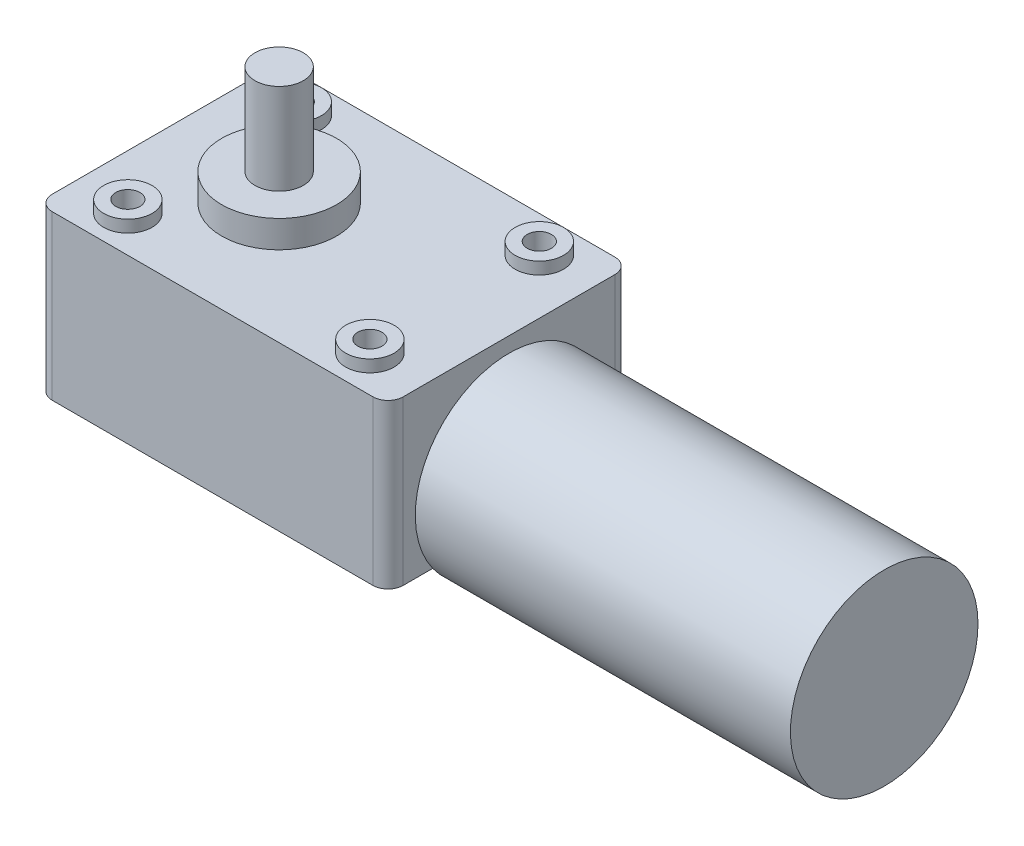
from build123d import *

# Parameters (mm, degrees)
BOSS_EXTRUDE1_DEPTH = 13.5
SKETCH2_R           = 4
BOSS_EXTRUDE2_DEPTH = 2
SKETCH3_R           = 2
CUT_EXTRUDE1_DEPTH  = 6
SKETCH6_R           = 9.5
BOSS_EXTRUDE5_DEPTH = 4.5
SKETCH4_R           = 4
BOSS_EXTRUDE3_DEPTH = 15
SKETCH5_R           = 15.5
BOSS_EXTRUDE4_DEPTH = 62
SKETCH7_R           = 4
CUT_EXTRUDE2_DEPTH  = 1.7


with BuildPart() as part:
    # Sketch1 → Boss-Extrude1 (new, symmetric)
    with BuildSketch(Plane(origin=(0, 0, 0), x_dir=(1, 0, 0), z_dir=(0, 1, 0))):
        with BuildLine():
            Line((-26.5, -20), (26.5, -20))
            ThreePointArc((26.5, -20), (28.267766953, -19.267766953), (29, -17.5))
            Line((29, -17.5), (29, 17.5))
            ThreePointArc((29, 17.5), (28.267766953, 19.267766953), (26.5, 20))
            Line((26.5, 20), (-26.5, 20))
            ThreePointArc((-26.5, 20), (-28.267766953, 19.267766953), (-29, 17.5))
            Line((-29, 17.5), (-29, -17.5))
            ThreePointArc((-29, -17.5), (-28.267766953, -19.267766953), (-26.5, -20))
        make_face()
    extrude(amount=BOSS_EXTRUDE1_DEPTH, both=True)

    # Sketch2 → Boss-Extrude2 (add)
    with BuildSketch(Plane(origin=(0, 13.5, 0), x_dir=(1, 0, 0), z_dir=(0, 1, 0))):
        with Locations(Location((-20, 14, 0), (0, 0, 270))):
            Circle(SKETCH2_R)
        with Locations(Location((-20, -14, 0), (0, 0, 270))):
            Circle(SKETCH2_R)
        with Locations(Location((20, -14, 0), (0, 0, 270))):
            Circle(SKETCH2_R)
        with Locations(Location((20, 14, 0), (0, 0, 270))):
            Circle(SKETCH2_R)
    boss_extrude2 = extrude(amount=BOSS_EXTRUDE2_DEPTH)

    # Sketch3 → Cut-Extrude1 (cut)
    with BuildSketch(Plane(origin=(0, 15.5, 0), x_dir=(1, 0, 0), z_dir=(0, 1, 0))):
        with Locations(Location((-20, 14, 0), (0, 0, 270))):
            Circle(SKETCH3_R)
        with Locations(Location((20, 14, 0), (0, 0, 270))):
            Circle(SKETCH3_R)
        with Locations(Location((20, -14, 0), (0, 0, 270))):
            Circle(SKETCH3_R)
        with Locations(Location((-20, -14, 0), (0, 0, 270))):
            Circle(SKETCH3_R)
    cut_extrude1 = extrude(amount=-CUT_EXTRUDE1_DEPTH, mode=Mode.SUBTRACT)

    # Sketch6 → Boss-Extrude5 (add)
    with BuildSketch(Plane(origin=(0, 13.5, 0), x_dir=(1, 0, 0), z_dir=(0, 1, 0))):
        with Locations(Location((-9, 0, 0), (0, 0, 270))):
            Circle(SKETCH6_R)
    boss_extrude5 = extrude(amount=BOSS_EXTRUDE5_DEPTH)

    # Sketch4 → Boss-Extrude3 (add)
    with BuildSketch(Plane(origin=(0, 18, 0), x_dir=(1, 0, 0), z_dir=(0, 1, 0))):
        with Locations(Location((-9, 0, 0), (0, 0, 270))):
            Circle(SKETCH4_R)
    extrude(amount=BOSS_EXTRUDE3_DEPTH)

    # Sketch5 → Boss-Extrude4 (add)
    with BuildSketch(Plane(origin=(29, 0, 0), x_dir=(0, 0, -1), z_dir=(1, 0, 0))):
        with Locations(Location((0, -4.5, 0), (0, 0, 215.49593265))):
            Circle(SKETCH5_R)
    extrude(amount=BOSS_EXTRUDE4_DEPTH)

    # Mirror2: Boss-Extrude2, Cut-Extrude1, Boss-Extrude5 across plane
    add(boss_extrude2.mirror(Plane.ZX))
    add(cut_extrude1.mirror(Plane.ZX), mode=Mode.SUBTRACT)
    add(boss_extrude5.mirror(Plane.ZX))

    # Sketch7 → Cut-Extrude2 (cut)
    with BuildSketch(Plane.XZ.offset(18)):
        with Locations(Location((-9, 0, 0), (0, 0, 90))):
            Circle(SKETCH7_R)
    extrude(amount=-CUT_EXTRUDE2_DEPTH, mode=Mode.SUBTRACT)


solid = part.part
